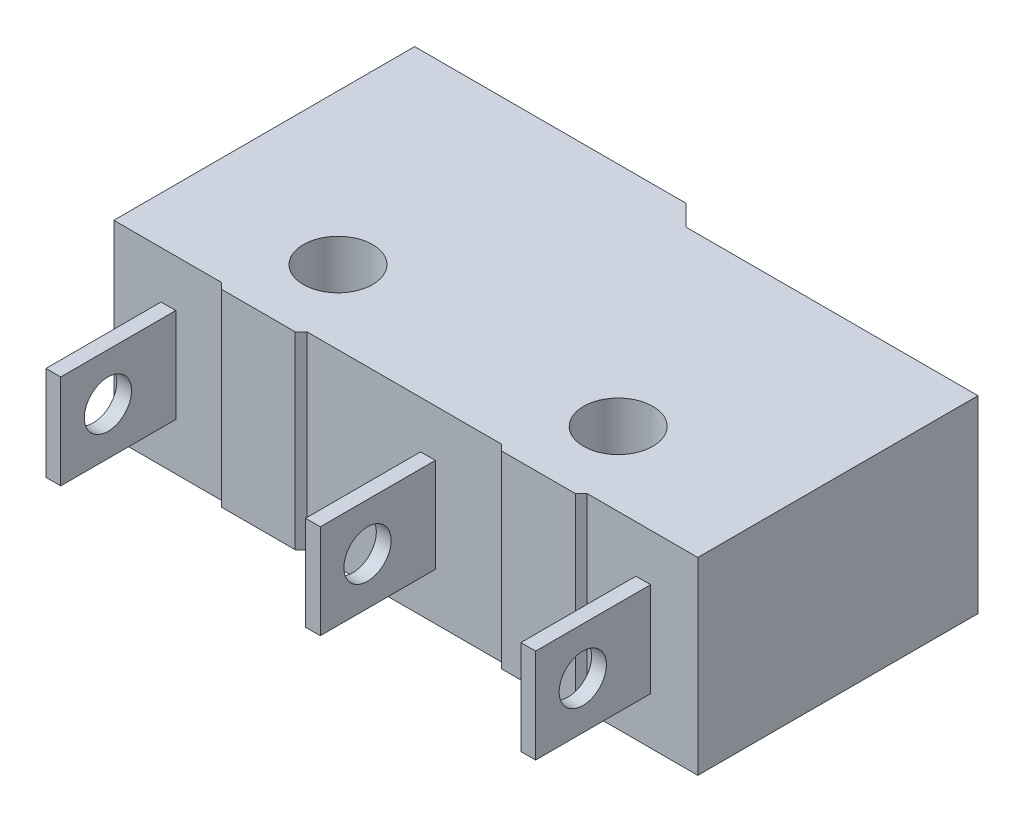
from build123d import *

# Parameters (mm, degrees)
SKETCH1_R           = 1.175
BOSS_EXTRUDE1_DEPTH = 6.4
BOSS_EXTRUDE2_DEPTH = 3.2
SKETCH4_W           = 0.5
SKETCH4_H           = 3.9
BOSS_EXTRUDE3_DEPTH = 3.2
SKETCH5_R           = 0.8
CUT_EXTRUDE1_DEPTH  = 22.246411462


with BuildPart() as part:
    # Sketch1 → Boss-Extrude1 (new body)
    with BuildSketch(Plane(origin=(0, 0, 0), x_dir=(1, 0, 0), z_dir=(0, 1, 0))):
        Polygon((-10.95, -2.5), (-10.75, -2.7), (-8.25, -2.7), (-8.05, -2.5), (-1.45, -2.5), (-1.25, -2.7), (1.25, -2.7), (1.45, -2.5), (5.2, -2.5), (5.2, 7), (-4.7, 7), (-5.4, 7.7), (-14.6, 7.7), (-14.6, -2.5), align=None)
        with Locations(Location((0, 0, 0), (0, 0, 270))):
            Circle(SKETCH1_R, mode=Mode.SUBTRACT)
        with Locations(Location((-9.5, 0, 0), (0, 0, 270))):
            Circle(SKETCH1_R, mode=Mode.SUBTRACT)
    extrude(amount=BOSS_EXTRUDE1_DEPTH)

    # Sketch3 → Boss-Extrude2 (add)
    with BuildSketch(Plane(origin=(0, 1.6, 0), x_dir=(1, 0, 0), z_dir=(0, 1, 0))):
        with BuildLine():
            Line((-8.5, 7), (-6.5, 7))
            Line((-6.5, 7), (-6.5, 7.9))
            ThreePointArc((-6.5, 7.9), (-7.5, 8.9), (-8.5, 7.9))
            Line((-8.5, 7.9), (-8.5, 7))
        make_face()
    extrude(amount=BOSS_EXTRUDE2_DEPTH)

    # Sketch4 → Boss-Extrude3 (add)
    with BuildSketch(Plane(origin=(0, 1.6, 0), x_dir=(1, 0, 0), z_dir=(0, 1, 0))):
        with Locations((-12.75, -4.45)):
            Rectangle(SKETCH4_W, SKETCH4_H)
        with Locations((-3.95, -4.45)):
            Rectangle(SKETCH4_W, SKETCH4_H)
        with Locations((3.35, -4.45)):
            Rectangle(SKETCH4_W, SKETCH4_H)
    extrude(amount=BOSS_EXTRUDE3_DEPTH)

    # Sketch5 → Cut-Extrude1 (cut, through all)
    with BuildSketch(Plane(origin=(3.6, 0, 0), x_dir=(0, 0, -1), z_dir=(1, 0, 0))):
        with Locations((-4.8, 3.2)):
            Circle(SKETCH5_R)
    extrude(amount=-CUT_EXTRUDE1_DEPTH, mode=Mode.SUBTRACT)


solid = part.part
